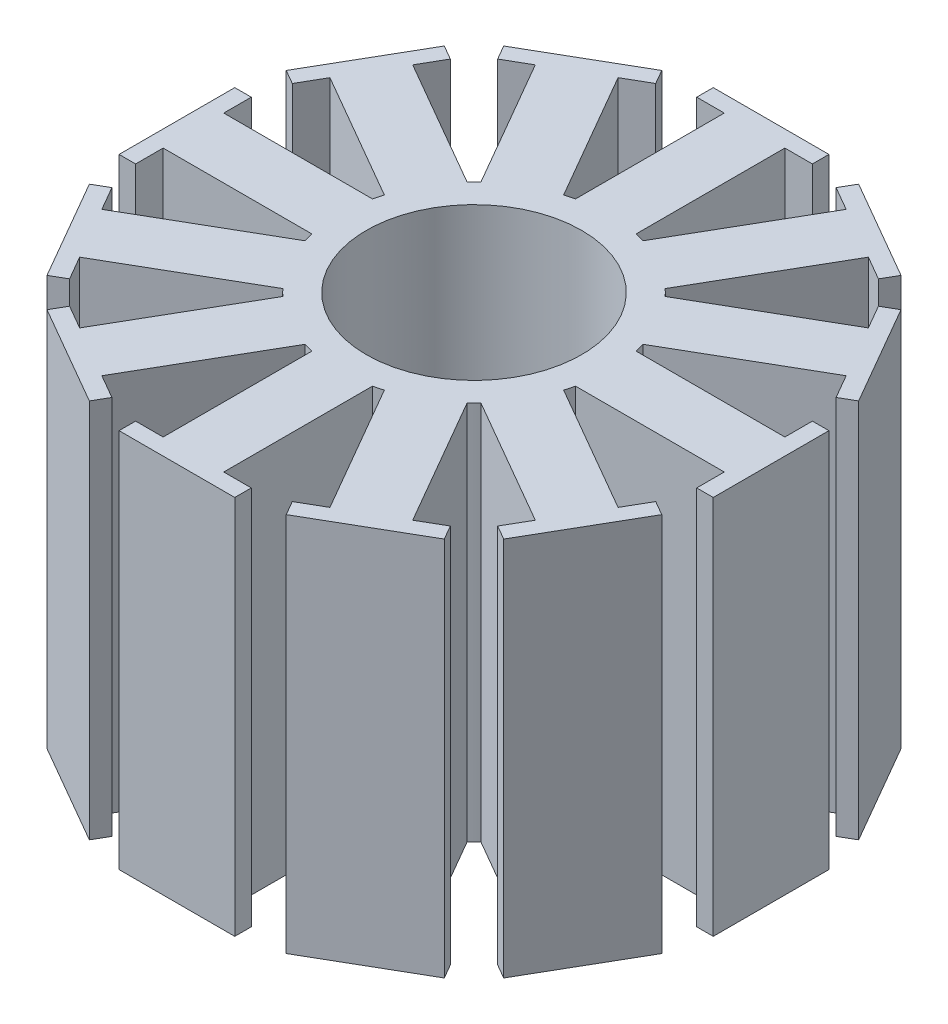
from build123d import *

# Parameters (mm, degrees)
SKETCH2_R           = 4.91
SKETCH2_R_2         = 3.91
BOSS_EXTRUDE1_DEPTH = 13.8
BOSS_EXTRUDE2_START = -13.8
BOSS_EXTRUDE2_DEPTH = 13.8


with BuildPart() as part:
    # Sketch2 → Boss-Extrude1 (new body)
    with BuildSketch(Plane(origin=(0, 0, 0), x_dir=(1, 0, 0), z_dir=(0, 1, 0))):
        with Locations(Location((0, 0, 0), (0, 0, 90))):
            Circle(SKETCH2_R)
        with Locations(Location((0, 0, 0), (0, 0, 90))):
            Circle(SKETCH2_R_2, mode=Mode.SUBTRACT)
    extrude(amount=BOSS_EXTRUDE1_DEPTH)

    # Sketch3 → Boss-Extrude2 (add)
    with BuildSketch(Plane(origin=(0, 13.8, 0), x_dir=(1, 0, 0), z_dir=(0, 1, 0)).offset(BOSS_EXTRUDE2_START)):
        with BuildLine():
            Line((4.785195921, 1.1), (10.185195921, 1.1))
            Line((10.185195921, 1.1), (10.185195921, 2.1))
            Line((10.185195921, 2.1), (10.785195921, 2.1))
            Line((10.785195921, 2.1), (10.785195921, -2.1))
            Line((10.785195921, -2.1), (10.185195921, -2.1))
            Line((10.185195921, -2.1), (10.185195921, -1.1))
            Line((10.185195921, -1.1), (4.785195921, -1.1))
            ThreePointArc((4.785195921, -1.1), (4.91, 0), (4.785195921, 1.1))
        make_face()
        with BuildLine():
            Line((4.694101229, -1.439970016), (9.37063841, -4.139970016))
            Line((9.37063841, -4.139970016), (9.87063841, -3.273944612))
            Line((9.87063841, -3.273944612), (10.390253652, -3.573944612))
            Line((10.390253652, -3.573944612), (8.290253652, -7.211251308))
            Line((8.290253652, -7.211251308), (7.77063841, -6.911251308))
            Line((7.77063841, -6.911251308), (8.27063841, -6.045225905))
            Line((8.27063841, -6.045225905), (3.594101229, -3.345225905))
            ThreePointArc((3.594101229, -3.345225905), (4.252184733, -2.455), (4.694101229, -1.439970016))
        make_face()
        with BuildLine():
            Line((3.345225905, -3.594101229), (6.045225905, -8.27063841))
            Line((6.045225905, -8.27063841), (6.911251308, -7.77063841))
            Line((6.911251308, -7.77063841), (7.211251308, -8.290253652))
            Line((7.211251308, -8.290253652), (3.573944612, -10.390253652))
            Line((3.573944612, -10.390253652), (3.273944612, -9.87063841))
            Line((3.273944612, -9.87063841), (4.139970016, -9.37063841))
            Line((4.139970016, -9.37063841), (1.439970016, -4.694101229))
            ThreePointArc((1.439970016, -4.694101229), (2.455, -4.252184733), (3.345225905, -3.594101229))
        make_face()
        with BuildLine():
            Line((1.1, -4.785195921), (1.1, -10.185195921))
            Line((1.1, -10.185195921), (2.1, -10.185195921))
            Line((2.1, -10.185195921), (2.1, -10.785195921))
            Line((2.1, -10.785195921), (-2.1, -10.785195921))
            Line((-2.1, -10.785195921), (-2.1, -10.185195921))
            Line((-2.1, -10.185195921), (-1.1, -10.185195921))
            Line((-1.1, -10.185195921), (-1.1, -4.785195921))
            ThreePointArc((-1.1, -4.785195921), (0, -4.91), (1.1, -4.785195921))
        make_face()
        with BuildLine():
            Line((-1.439970016, -4.694101229), (-4.139970016, -9.37063841))
            Line((-4.139970016, -9.37063841), (-3.273944612, -9.87063841))
            Line((-3.273944612, -9.87063841), (-3.573944612, -10.390253652))
            Line((-3.573944612, -10.390253652), (-7.211251308, -8.290253652))
            Line((-7.211251308, -8.290253652), (-6.911251308, -7.77063841))
            Line((-6.911251308, -7.77063841), (-6.045225905, -8.27063841))
            Line((-6.045225905, -8.27063841), (-3.345225905, -3.594101229))
            ThreePointArc((-3.345225905, -3.594101229), (-2.455, -4.252184733), (-1.439970016, -4.694101229))
        make_face()
        with BuildLine():
            Line((-3.594101229, -3.345225905), (-8.27063841, -6.045225905))
            Line((-8.27063841, -6.045225905), (-7.77063841, -6.911251308))
            Line((-7.77063841, -6.911251308), (-8.290253652, -7.211251308))
            Line((-8.290253652, -7.211251308), (-10.390253652, -3.573944612))
            Line((-10.390253652, -3.573944612), (-9.87063841, -3.273944612))
            Line((-9.87063841, -3.273944612), (-9.37063841, -4.139970016))
            Line((-9.37063841, -4.139970016), (-4.694101229, -1.439970016))
            ThreePointArc((-4.694101229, -1.439970016), (-4.252184733, -2.455), (-3.594101229, -3.345225905))
        make_face()
        with BuildLine():
            Line((-4.785195921, -1.1), (-10.185195921, -1.1))
            Line((-10.185195921, -1.1), (-10.185195921, -2.1))
            Line((-10.185195921, -2.1), (-10.785195921, -2.1))
            Line((-10.785195921, -2.1), (-10.785195921, 2.1))
            Line((-10.785195921, 2.1), (-10.185195921, 2.1))
            Line((-10.185195921, 2.1), (-10.185195921, 1.1))
            Line((-10.185195921, 1.1), (-4.785195921, 1.1))
            ThreePointArc((-4.785195921, 1.1), (-4.91, 0), (-4.785195921, -1.1))
        make_face()
        with BuildLine():
            Line((-4.694101229, 1.439970016), (-9.37063841, 4.139970016))
            Line((-9.37063841, 4.139970016), (-9.87063841, 3.273944612))
            Line((-9.87063841, 3.273944612), (-10.390253652, 3.573944612))
            Line((-10.390253652, 3.573944612), (-8.290253652, 7.211251308))
            Line((-8.290253652, 7.211251308), (-7.77063841, 6.911251308))
            Line((-7.77063841, 6.911251308), (-8.27063841, 6.045225905))
            Line((-8.27063841, 6.045225905), (-3.594101229, 3.345225905))
            ThreePointArc((-3.594101229, 3.345225905), (-4.252184733, 2.455), (-4.694101229, 1.439970016))
        make_face()
        with BuildLine():
            Line((-3.345225905, 3.594101229), (-6.045225905, 8.27063841))
            Line((-6.045225905, 8.27063841), (-6.911251308, 7.77063841))
            Line((-6.911251308, 7.77063841), (-7.211251308, 8.290253652))
            Line((-7.211251308, 8.290253652), (-3.573944612, 10.390253652))
            Line((-3.573944612, 10.390253652), (-3.273944612, 9.87063841))
            Line((-3.273944612, 9.87063841), (-4.139970016, 9.37063841))
            Line((-4.139970016, 9.37063841), (-1.439970016, 4.694101229))
            ThreePointArc((-1.439970016, 4.694101229), (-2.455, 4.252184733), (-3.345225905, 3.594101229))
        make_face()
        with BuildLine():
            Line((-1.1, 4.785195921), (-1.1, 10.185195921))
            Line((-1.1, 10.185195921), (-2.1, 10.185195921))
            Line((-2.1, 10.185195921), (-2.1, 10.785195921))
            Line((-2.1, 10.785195921), (2.1, 10.785195921))
            Line((2.1, 10.785195921), (2.1, 10.185195921))
            Line((2.1, 10.185195921), (1.1, 10.185195921))
            Line((1.1, 10.185195921), (1.1, 4.785195921))
            ThreePointArc((1.1, 4.785195921), (0, 4.91), (-1.1, 4.785195921))
        make_face()
        with BuildLine():
            Line((1.439970016, 4.694101229), (4.139970016, 9.37063841))
            Line((4.139970016, 9.37063841), (3.273944612, 9.87063841))
            Line((3.273944612, 9.87063841), (3.573944612, 10.390253652))
            Line((3.573944612, 10.390253652), (7.211251308, 8.290253652))
            Line((7.211251308, 8.290253652), (6.911251308, 7.77063841))
            Line((6.911251308, 7.77063841), (6.045225905, 8.27063841))
            Line((6.045225905, 8.27063841), (3.345225905, 3.594101229))
            ThreePointArc((3.345225905, 3.594101229), (2.455, 4.252184733), (1.439970016, 4.694101229))
        make_face()
        with BuildLine():
            Line((3.594101229, 3.345225905), (8.27063841, 6.045225905))
            Line((8.27063841, 6.045225905), (7.77063841, 6.911251308))
            Line((7.77063841, 6.911251308), (8.290253652, 7.211251308))
            Line((8.290253652, 7.211251308), (10.390253652, 3.573944612))
            Line((10.390253652, 3.573944612), (9.87063841, 3.273944612))
            Line((9.87063841, 3.273944612), (9.37063841, 4.139970016))
            Line((9.37063841, 4.139970016), (4.694101229, 1.439970016))
            ThreePointArc((4.694101229, 1.439970016), (4.252184733, 2.455), (3.594101229, 3.345225905))
        make_face()
    extrude(amount=BOSS_EXTRUDE2_DEPTH)


solid = part.part
